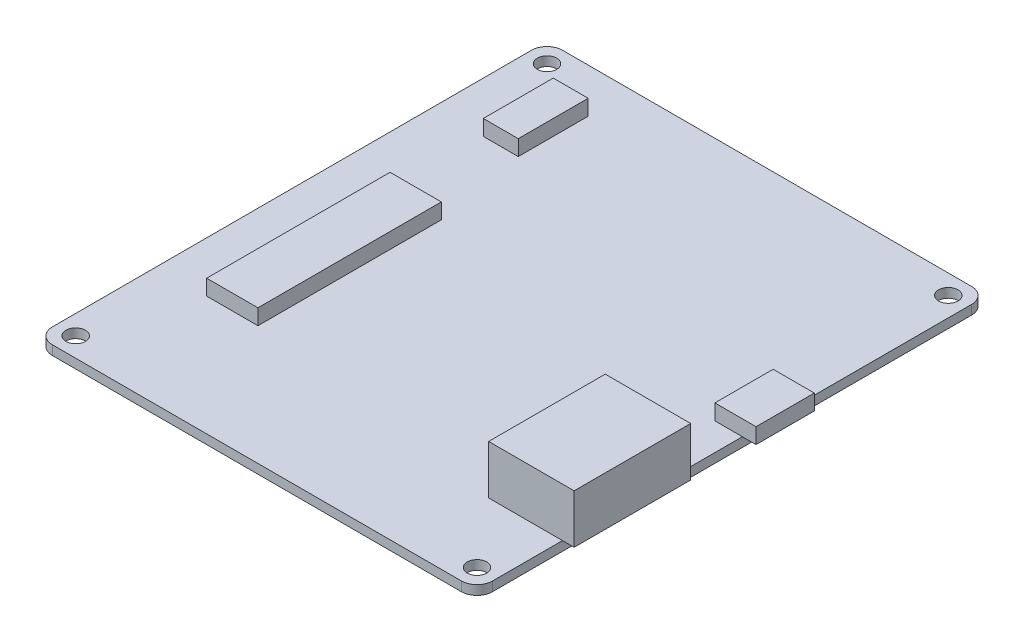
from build123d import *

# Parameters (mm, degrees)
EXTRUDE_1_DEPTH = 1.2
MM_1_D          = 2.5
SKETCH_4_W      = 6.6
SKETCH_4_H      = 23.6
SKETCH_4_W_2    = 4.5
SKETCH_4_H_2    = 9
SKETCH_4_W_3    = 5.3
SKETCH_4_H_3    = 7.5
EXTRUDE_2_DEPTH = 2
SKETCH_5_W      = 11
SKETCH_5_H      = 15
EXTRUDE_3_DEPTH = 6.3


with BuildPart() as part:
    # 草图1 → 凸台-拉伸1 (new body)
    with BuildSketch(Plane(origin=(0, 0, 0), x_dir=(1, 0, 0), z_dir=(0, 1, 0))):
        with BuildLine():
            Line((-26.32, -32.825), (26.32, -32.825))
            ThreePointArc((26.32, -32.825), (27.734213562, -32.239213562), (28.32, -30.825))
            Line((28.32, -30.825), (28.32, 30.825))
            ThreePointArc((28.32, 30.825), (27.734213562, 32.239213562), (26.32, 32.825))
            Line((26.32, 32.825), (-26.32, 32.825))
            ThreePointArc((-26.32, 32.825), (-27.734213562, 32.239213562), (-28.32, 30.825))
            Line((-28.32, 30.825), (-28.32, -30.825))
            ThreePointArc((-28.32, -30.825), (-27.734213562, -32.239213562), (-26.32, -32.825))
        make_face()
    extrude(amount=EXTRUDE_1_DEPTH)

    # 大小mm 暗销孔1 (through all)
    with Locations(Plane(origin=(0, 1.2, 0), x_dir=(1, 0, 0), z_dir=(0, 1, 0))):
        with Locations((-25.82, 30.325), (-25.82, -30.325), (25.82, -30.325), (25.82, 30.325)):
            Hole(MM_1_D / 2)

    # 草图4 → 凸台-拉伸2 (add)
    with BuildSketch(Plane(origin=(0, 1.2, 0), x_dir=(1, 0, 0), z_dir=(0, 1, 0))):
        with Locations((-18.52, -5.675)):
            Rectangle(SKETCH_4_W, SKETCH_4_H)
        with Locations((-19.57, 22.625)):
            Rectangle(SKETCH_4_W_2, SKETCH_4_H_2)
        with Locations((27.43, 5.075)):
            Rectangle(SKETCH_4_W_3, SKETCH_4_H_3)
    extrude(amount=EXTRUDE_2_DEPTH)

    # 草图5 → 凸台-拉伸3 (add)
    with BuildSketch(Plane(origin=(0, 1.2, 0), x_dir=(1, 0, 0), z_dir=(0, 1, 0))):
        with Locations((24.32, -14.325)):
            Rectangle(SKETCH_5_W, SKETCH_5_H)
    extrude(amount=EXTRUDE_3_DEPTH)


solid = part.part
